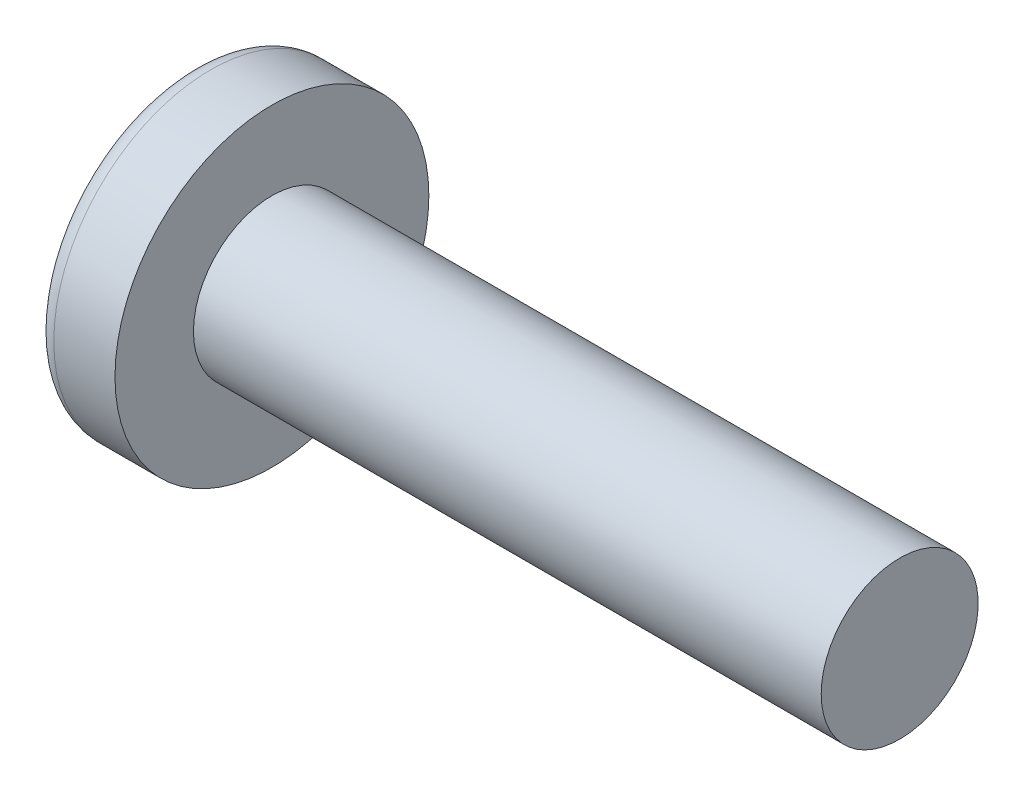
from build123d import *

# Parameters (mm, degrees)
CIRPATTERN1_COUNT = 4


with BuildPart() as part:
    # BodySke → Base-Revolve (revolve)
    with BuildSketch(Plane.XY, mode=Mode.PRIVATE) as base_revolve_sk:
        with BuildLine():
            Line((1.6, 1), (1.6, 2))
            Line((1.6, 2), (0.820084035, 2))
            ThreePointArc((0.820084035, 2), (0.712029995, 1.974299613), (0.627117876, 1.902702703))
            ThreePointArc((0.627117876, 1.902702703), (0.160820604, 1.001692868), (0, 0))
            Line((0, 0), (9.6, 0))
            Line((9.6, 0), (9.6, 1))
            Line((9.6, 1), (1.6, 1))
        make_face()
    revolve(base_revolve_sk.sketch.rotate(Axis((-25.4, 0, 0), (1, 0, 0)), 90), axis=Axis((-25.4, 0, 0), (1, 0, 0)))

    # Sketch3 → Cut-Loft1 section 0
    with BuildSketch(Plane(origin=(0, 0, 0), x_dir=(0, 0, -1), z_dir=(1, 0, 0))):
        with BuildLine():
            Line((0.5, 0.63), (0.02, 0.63))
            Line((0.02, 0.63), (0.02, 2.45))
            Line((0.02, 2.45), (0.5, 2.45))
            Line((0.5, 2.45), (0.5, 0.63))
        make_face()
    # Sketch4 → Cut-Loft1 section 1
    with BuildSketch(Plane(origin=(1.19, 0, 0), x_dir=(0, 0, -1), z_dir=(1, 0, 0))):
        with BuildLine():
            Line((0.25, -0.25), (-0.25, -0.25))
            Line((-0.25, -0.25), (-0.25, 0.25))
            Line((-0.25, 0.25), (0.25, 0.25))
            Line((0.25, 0.25), (0.25, -0.25))
        make_face()
    cut_loft1 = loft(mode=Mode.SUBTRACT)

    # CirPattern1: Cut-Loft1 ×4 about axis
    cirpattern1_axis = Axis((0, 0, 0), (1, 0, 0))
    for i in range(1, CIRPATTERN1_COUNT):
        add(cut_loft1.rotate(cirpattern1_axis, i * 360 / CIRPATTERN1_COUNT), mode=Mode.SUBTRACT)


solid = part.part
